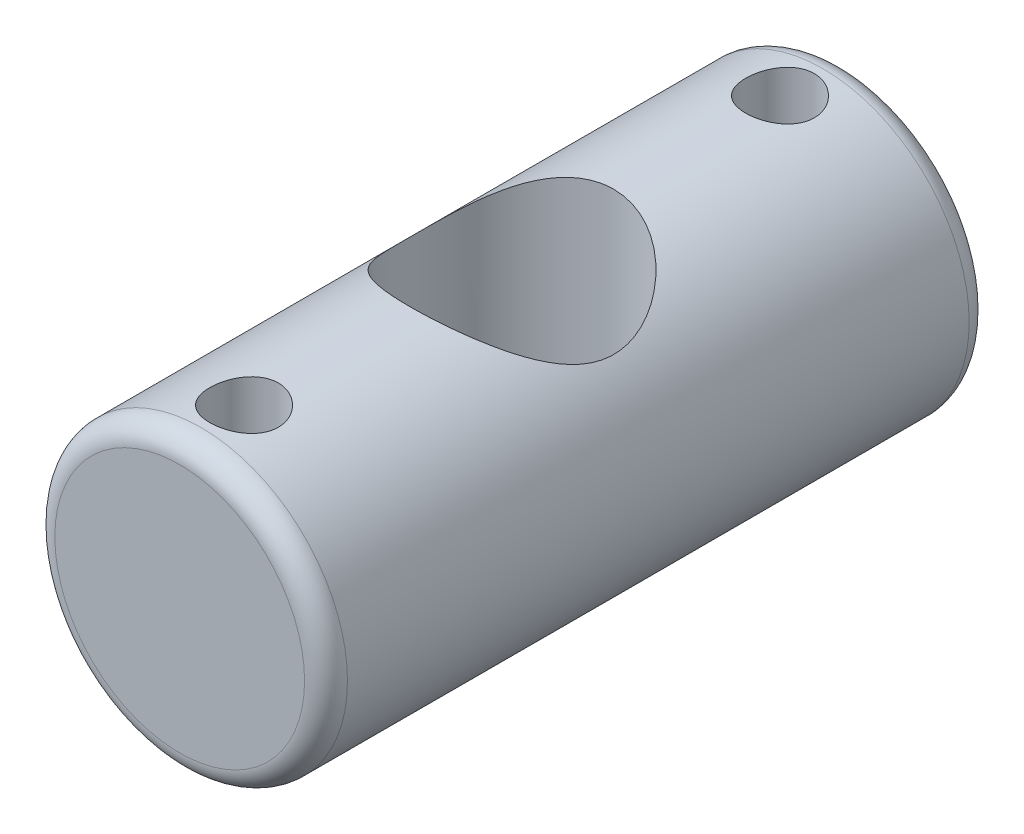
from build123d import *

# Parameters (mm, degrees)
BOSS_EXTRUDE1_DEPTH      = 15.5
BOSS_EXTRUDE1_DEPTH_BACK = 15.5
SKETCH1_R                = 6.825
CUT_EXTRUDE1_DEPTH       = 10
CUT_EXTRUDE1_DEPTH_BACK  = 10
SKETCH2_R                = 4.75
SKETCH2_R_2              = 1.6
FILLET1_R                = 1


with BuildPart() as part:
    # Sketch1 → Boss-Extrude1 (new, two sides: drawn at the far end of the back side and taken through both)
    with BuildSketch(Plane.XY.offset(-BOSS_EXTRUDE1_DEPTH_BACK)):
        Circle(SKETCH1_R)
    extrude(amount=BOSS_EXTRUDE1_DEPTH + BOSS_EXTRUDE1_DEPTH_BACK)

    # Sketch2 → Cut-Extrude1 (cut, two sides: drawn at the far end of the back side and taken through both)
    with BuildSketch(Plane(origin=(0, 0, 0), x_dir=(1, 0, 0), z_dir=(0, 1, 0)).offset(-CUT_EXTRUDE1_DEPTH_BACK)):
        Circle(SKETCH2_R)
        with Locations((0, -12.5)):
            Circle(SKETCH2_R_2)
        with Locations((0, 12.5)):
            Circle(SKETCH2_R_2)
    extrude(amount=CUT_EXTRUDE1_DEPTH + CUT_EXTRUDE1_DEPTH_BACK, mode=Mode.SUBTRACT)

    # Fillet1
    fillet1_edges = [part.edges().sort_by_distance(p)[0] for p in [
        (-6.825, 0, 15.5),
        (-6.825, 0, -15.5),
    ]]
    fillet(fillet1_edges, radius=FILLET1_R)


solid = part.part
